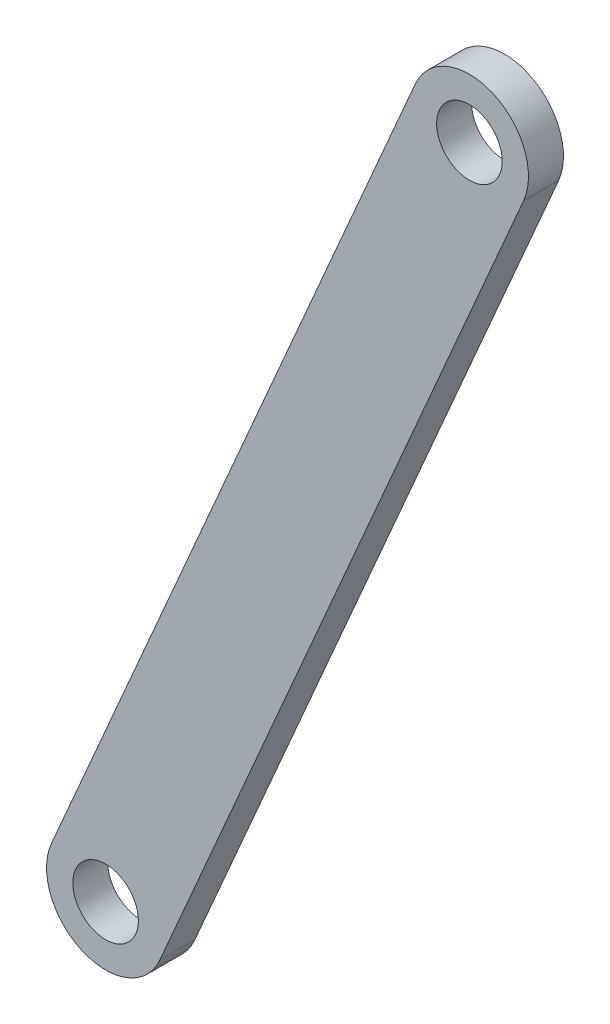
from build123d import *

# Parameters (mm, degrees)
SKETCH1_R           = 46.875
BOSS_EXTRUDE1_DEPTH = 50


with BuildPart() as part:
    # Sketch1 → Boss-Extrude1 (new body)
    with BuildSketch(Plane.XY):
        with BuildLine():
            Line((-77.418755886, 33.54812755), (442.581244114, 1233.54812755))
            ThreePointArc((442.581244114, 1233.54812755), (553.54812755, 1277.418755886), (597.418755886, 1166.45187245))
            Line((597.418755886, 1166.45187245), (77.418755886, -33.54812755))
            ThreePointArc((77.418755886, -33.54812755), (-33.54812755, -77.418755886), (-77.418755886, 33.54812755))
        make_face()
        with Locations((520, 1200)):
            Circle(SKETCH1_R, mode=Mode.SUBTRACT)
        Circle(SKETCH1_R, mode=Mode.SUBTRACT)
    extrude(amount=BOSS_EXTRUDE1_DEPTH)


solid = part.part
